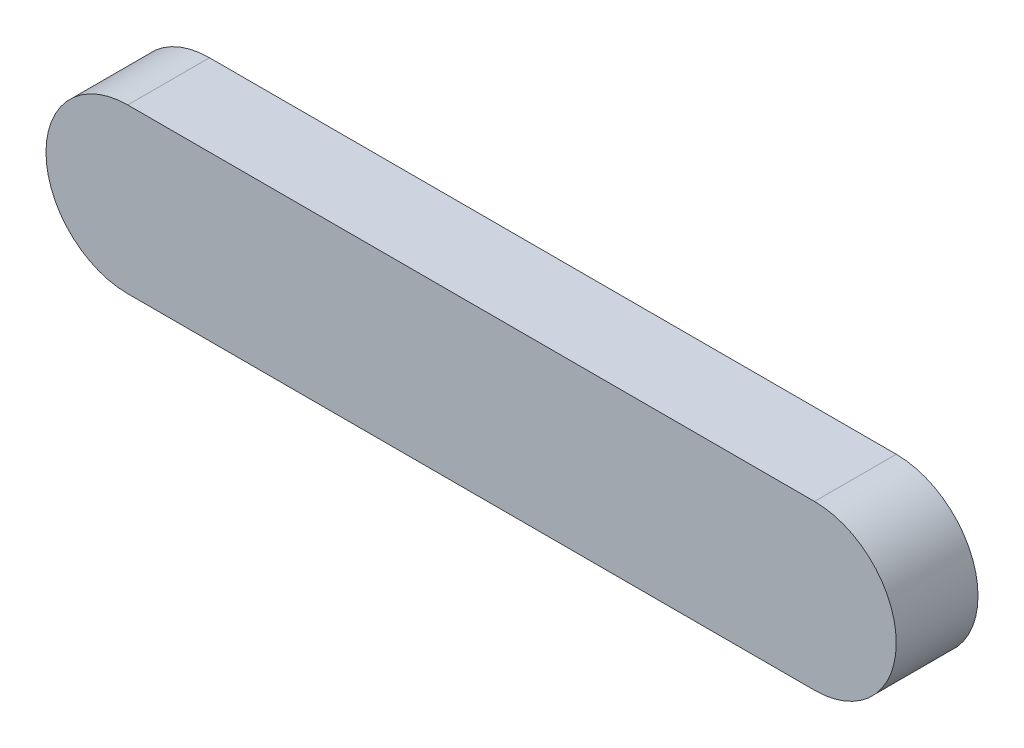
from build123d import *

# Parameters (mm, degrees)
BOSS_EXTRUDE1_DEPTH = 2.5


with BuildPart() as part:
    # Sketch1 → Boss-Extrude1 (new, symmetric)
    with BuildSketch(Plane.XY):
        with BuildLine():
            Line((-21, 5), (21, 5))
            ThreePointArc((21, 5), (26, 0), (21, -5))
            Line((21, -5), (-21, -5))
            ThreePointArc((-21, -5), (-26, 0), (-21, 5))
        make_face()
    extrude(amount=BOSS_EXTRUDE1_DEPTH, both=True)


solid = part.part
